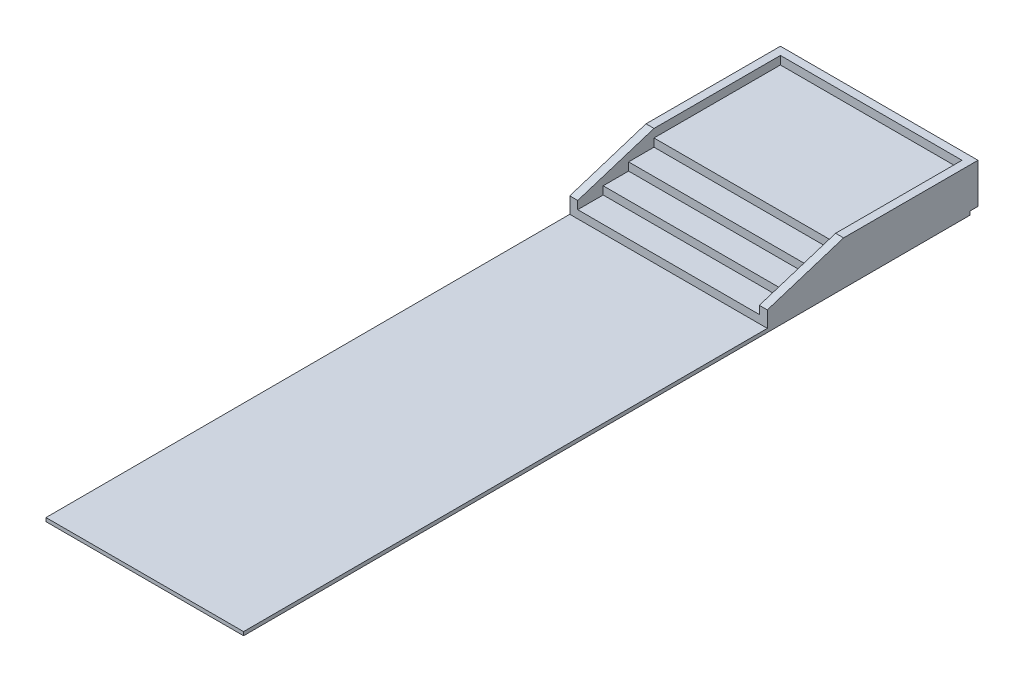
from build123d import *

# Parameters (mm, degrees)
BOSS_EXTRUDE1_DEPTH = 500
BOSS_EXTRUDE2_DEPTH = 22
LPATTERN1_COUNT     = 2
LPATTERN1_PITCH     = 522
SKETCH3_W           = 22
SKETCH3_H           = 110
BOSS_EXTRUDE3_DEPTH = 500
SKETCH4_W           = 544
SKETCH4_H           = 2000
BOSS_EXTRUDE4_DEPTH = 10


with BuildPart() as part:
    # Sketch1 → Boss-Extrude1 (new body)
    with BuildSketch(Plane(origin=(0, 0, 0), x_dir=(0, 0, -1), z_dir=(1, 0, 0))):
        Polygon((1.256226638, 87.216565021), (349.256226638, 87.216565021), (349.256226638, 0), (-208.743773362, -0.783434979), (-208.743773362, 21.216565021), (-138.743773362, 21.216565021), (-138.743773362, 43.216565021), (-68.743773362, 43.216565021), (-68.743773362, 65.216565021), (1.256226638, 65.216565021), align=None)
    extrude(amount=BOSS_EXTRUDE1_DEPTH)

    # Sketch2 → Boss-Extrude2 (add)
    with BuildSketch(Plane(origin=(500, 0, 0), x_dir=(0, 0, -1), z_dir=(1, 0, 0))):
        Polygon((-208.743773362, -0.783434979), (-208.743773362, 43.216565021), (1.256226638, 110), (371.256226638, 110), (371.256226638, 0), (349.256226638, 0), align=None)
    boss_extrude2 = extrude(amount=BOSS_EXTRUDE2_DEPTH)

    # LPattern1: Boss-Extrude2 ×2
    with Locations(*[(-i * LPATTERN1_PITCH, 0, 0) for i in range(1, LPATTERN1_COUNT)]):
        add(boss_extrude2)

    # Sketch3 → Boss-Extrude3 (add)
    with BuildSketch(Plane(origin=(0, 0, 0), x_dir=(0, 0, -1), z_dir=(1, 0, 0))):
        with Locations((360.256226638, 55)):
            Rectangle(SKETCH3_W, SKETCH3_H)
    extrude(amount=BOSS_EXTRUDE3_DEPTH)

    # Sketch4 → Boss-Extrude4 (add)
    with BuildSketch(Plane(origin=(0, -0.49035664, -0.000688463), x_dir=(1, 0, 0), z_dir=(0, -0.9999990143859607, -0.0014040039555169115))):
        with Locations((250, 650.744117594)):
            Rectangle(SKETCH4_W, SKETCH4_H)
    extrude(amount=BOSS_EXTRUDE4_DEPTH)


solid = part.part
